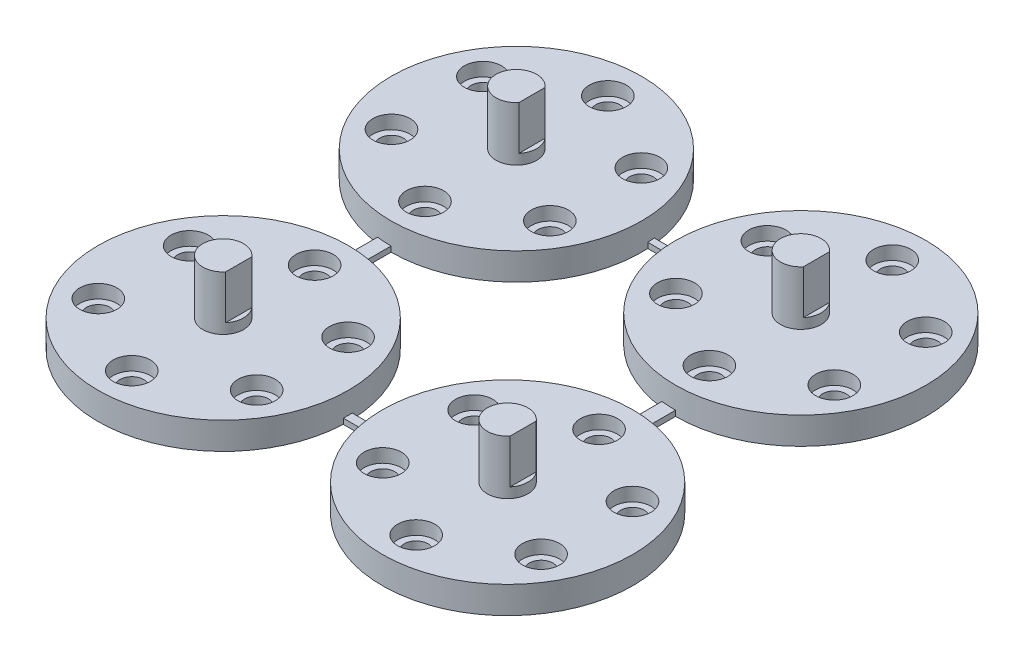
from build123d import *

# Parameters (mm, degrees)
SKETCH_1_W                   = 18.5
SKETCH_1_H                   = 4
HOLE_WIZARD_M3_1_D           = 3.5
HOLE_WIZARD_M3_1_CBORE_D     = 5.5
HOLE_WIZARD_M3_1_CBORE_DEPTH = 2
SKETCH_9_R                   = 4.078764036
EXTRUDE_2_DEPTH              = 4
SKETCH_10_R                  = 3
EXTRUDE_3_DEPTH              = 8
CUT_EXTRUDE_START            = -6.5
CUT_EXTRUDE_2_DEPTH          = 6.5
PATTERN_CIRCULAR_1_COUNT     = 3
PATTERN_CIRCULAR_1_ANGLE     = 120
SKETCH_13_W                  = 2.125984269
SKETCH_13_H                  = 7.532431529
EXTRUDE_4_DEPTH              = 0.8
SKETCH_14_W                  = 7.649512524
SKETCH_14_H                  = 1.311345004
SKETCH_14_H_2                = 1.033306543
EXTRUDE_5_DEPTH              = 0.8


with BuildPart() as part:
    # 草图1 → 旋转1 (revolve)
    with BuildSketch(Plane.XY.offset(0.922906258), mode=Mode.PRIVATE) as revolve_1_sk:
        with Locations((9.859359688, 2)):
            Rectangle(SKETCH_1_W, SKETCH_1_H)
    revolve(revolve_1_sk.sketch.rotate(Axis((0.609359688, 4, 0.922906258), (0, -1, 0)), 270), axis=Axis((0.609359688, 4, 0.922906258), (0, -1, 0)))

    # M3 六角头机械螺钉的柱形沉头孔1 (through all)
    with Locations(Plane(origin=(0, 4, 0), x_dir=(1, 0, 0), z_dir=(0, 1, 0))):
        with Locations((-11.081983263, -7.672906258), (12.300702639, -7.672906258), (0.609359688, 12.577093742)):
            hole_wizard_m3_1 = CounterBoreHole(HOLE_WIZARD_M3_1_D / 2, HOLE_WIZARD_M3_1_CBORE_D / 2, HOLE_WIZARD_M3_1_CBORE_DEPTH)

    # 草图9 → 凸台-拉伸2 (add)
    with BuildSketch(Plane.XZ):
        with Locations((0.609359688, 0.922906258)):
            Circle(SKETCH_9_R)
    extrude(amount=-EXTRUDE_2_DEPTH)

    # 草图10 → 凸台-拉伸3 (add)
    with BuildSketch(Plane(origin=(0, 4, 0), x_dir=(1, 0, 0), z_dir=(0, 1, 0))):
        with Locations(Location((0.609359688, -0.922906258, 0), (0, 0, 270))):
            Circle(SKETCH_10_R)
    extrude(amount=EXTRUDE_3_DEPTH)

    # 草图11 → 切除-拉伸2 (cut)
    with BuildSketch(Plane(origin=(0, 12, 0), x_dir=(1, 0, 0), z_dir=(0, 1, 0)).offset(CUT_EXTRUDE_START)):
        with BuildLine():
            Line((2.905866026, 1.007393885), (2.905866026, -2.853206401))
            ThreePointArc((2.905866026, -2.853206401), (3.609359688, -0.922906258), (2.905866026, 1.007393885))
        make_face()
    extrude(amount=CUT_EXTRUDE_2_DEPTH, mode=Mode.SUBTRACT)

    # 阵列(圆周)1: M3 六角头机械螺钉的柱形沉头孔1 ×3 about axis
    pattern_circular_1_axis = Axis((0.609359688, 0, 0.922906258), (0, -1, 0))
    for i in range(1, PATTERN_CIRCULAR_1_COUNT):
        add(hole_wizard_m3_1.rotate(pattern_circular_1_axis, i * PATTERN_CIRCULAR_1_ANGLE / (PATTERN_CIRCULAR_1_COUNT - 1)), mode=Mode.SUBTRACT)


with BuildPart() as body_2:
    # Move Body 3: copy of part
    add(part.part.moved(Location((0, 0, 43.295994543))))


with BuildPart() as part_1:
    add(part.part)

    add(body_2.part)  # 凸台-拉伸4 merges body 2
    # 草图13 → 凸台-拉伸4 (add)
    with BuildSketch(Plane.XZ):
        with Locations((-0.453632447, 22.075248032)):
            Rectangle(SKETCH_13_W, SKETCH_13_H)
    extrude(amount=-EXTRUDE_4_DEPTH)


with BuildPart() as body_2_2:
    # Move Body 4: copy of part
    add(part_1.part.moved(Location((42, 0, 0))))


with BuildPart() as part_2:
    add(part_1.part)

    add(body_2_2.part)  # 凸台-拉伸5 merges body 2 2
    # 草图14 → 凸台-拉伸5 (add)
    with BuildSketch(Plane.XZ):
        with Locations((21.609359688, 44.317374847)):
            Rectangle(SKETCH_14_W, SKETCH_14_H)
        with Locations((21.609359688, -0.516653272)):
            Rectangle(SKETCH_14_W, SKETCH_14_H_2)
    extrude(amount=-EXTRUDE_5_DEPTH)


solid = part_2.part
